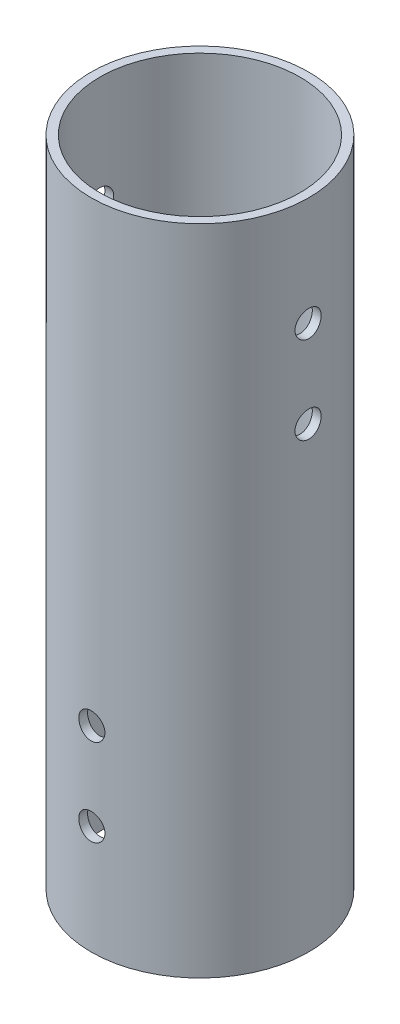
from build123d import *

# Parameters (mm, degrees)
SKETCH_1_R               = 25
SKETCH_1_R_2             = 23
EXTRUDE_1_DEPTH          = 150
CUT_EXTRUDE_1_DEPTH      = 155.110350074
CUT_EXTRUDE_1_DEPTH_BACK = 155.110350074
SKETCH_2_R               = 3
CUT_EXTRUDE_2_DEPTH      = 155.110350204
CUT_EXTRUDE_2_DEPTH_BACK = 155.110350204
SKETCH_3_R               = 3


with BuildPart() as part:
    # 草图1 → 凸台-拉伸1 (new body)
    with BuildSketch(Plane(origin=(0, 0, 0), x_dir=(1, 0, 0), z_dir=(0, 1, 0))):
        with Locations(Location((0, 0, 0), (0, 0, 270))):
            Circle(SKETCH_1_R)
        with Locations(Location((0, 0, 0), (0, 0, 270))):
            Circle(SKETCH_1_R_2, mode=Mode.SUBTRACT)
    extrude(amount=EXTRUDE_1_DEPTH)

    # 草图2 → 切除-拉伸1 (cut, two sides: drawn at the far end of the back side and taken through both)
    with BuildSketch(Plane.XY.offset(-CUT_EXTRUDE_1_DEPTH_BACK)):
        with Locations((0, 45)):
            Circle(SKETCH_2_R)
        with Locations((0, 25)):
            Circle(SKETCH_2_R)
    extrude(amount=CUT_EXTRUDE_1_DEPTH + CUT_EXTRUDE_1_DEPTH_BACK, mode=Mode.SUBTRACT)

    # 草图3 → 切除-拉伸2 (cut, two sides: drawn at the far end of the back side and taken through both)
    with BuildSketch(Plane(origin=(0, 0, 0), x_dir=(0, 0, -1), z_dir=(1, 0, 0)).offset(-CUT_EXTRUDE_2_DEPTH_BACK)):
        with Locations((0, 125)):
            Circle(SKETCH_3_R)
        with Locations((0, 105)):
            Circle(SKETCH_3_R)
    extrude(amount=CUT_EXTRUDE_2_DEPTH + CUT_EXTRUDE_2_DEPTH_BACK, mode=Mode.SUBTRACT)


solid = part.part
